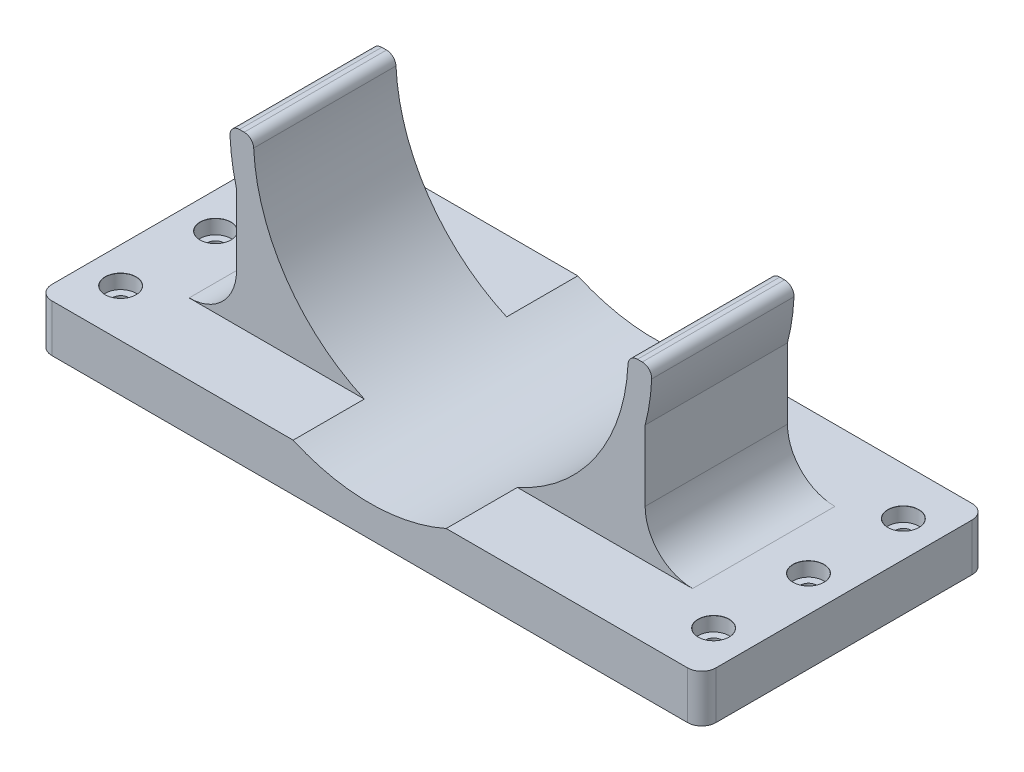
from build123d import *

# Parameters (mm, degrees)
BOSS_EXTRUDE3_DEPTH           = 30
BOSS_EXTRUDE3_DEPTH_BACK      = 30
BOSS_EXTRUDE4_DEPTH           = 15
BOSS_EXTRUDE4_DEPTH_BACK      = 15
BOSS_EXTRUDE5_DEPTH           = 15
BOSS_EXTRUDE5_DEPTH_BACK      = 15
FILLET1_R                     = 10
CBORE_FOR_M3_SHCS1_AT_2_COUNT = 2
CBORE_FOR_M3_SHCS1_AT_2_PITCH = 125
LPATTERN1_COUNT               = 2
LPATTERN1_PITCH               = 20
LPATTERN1_COL_COUNT           = 2
LPATTERN1_COL_PITCH           = 20
FILLET2_R                     = 2
FILLET3_R                     = 3


with BuildPart() as part:
    # Sketch1 → Boss-Extrude3 (new, two sides: drawn at the far end of the back side and taken through both)
    with BuildSketch(Plane.XY.offset(-BOSS_EXTRUDE3_DEPTH_BACK)):
        with BuildLine():
            Line((-43.065388601, -36.056178761), (-70, -36.056178761))
            Line((-70, -36.056178761), (-70, -46.056178761))
            Line((-70, -46.056178761), (70, -46.056178761))
            Line((70, -46.056178761), (70, -36.056178761))
            Line((70, -36.056178761), (43.065388601, -36.056178761))
            Line((43.065388601, -36.056178761), (26.080681992, -36.056178761))
            Line((26.080681992, -36.056178761), (16.130777202, -36.056178761))
            ThreePointArc((16.130777202, -36.056178761), (0, -39.5), (-16.130777202, -36.056178761))
            Line((-16.130777202, -36.056178761), (-26.080681992, -36.056178761))
            Line((-26.080681992, -36.056178761), (-43.065388601, -36.056178761))
        make_face()
    extrude(amount=BOSS_EXTRUDE3_DEPTH + BOSS_EXTRUDE3_DEPTH_BACK)

    # Sketch1<6> → Boss-Extrude4 (add, two sides: drawn at the far end of the back side and taken through both)
    with BuildSketch(Plane.XY.offset(-BOSS_EXTRUDE4_DEPTH_BACK)):
        with BuildLine():
            ThreePointArc((-44.5, 0), (-39.628527279, -20.24425414), (-26.080681992, -36.056178761))
            Line((-26.080681992, -36.056178761), (-16.130777202, -36.056178761))
            ThreePointArc((-16.130777202, -36.056178761), (-33.146762281, -21.483532071), (-39.5, 0))
            Line((-39.5, 0), (-44.5, 0))
        make_face()
        with BuildLine():
            ThreePointArc((39.5, 0), (33.146762281, -21.483532071), (16.130777202, -36.056178761))
            Line((16.130777202, -36.056178761), (26.080681992, -36.056178761))
            ThreePointArc((26.080681992, -36.056178761), (39.628527279, -20.24425414), (44.5, 0))
            Line((44.5, 0), (39.5, 0))
        make_face()
    extrude(amount=BOSS_EXTRUDE4_DEPTH + BOSS_EXTRUDE4_DEPTH_BACK)

    # Sketch1<7> → Boss-Extrude5 (add, two sides: drawn at the far end of the back side and taken through both)
    with BuildSketch(Plane.XY.offset(-BOSS_EXTRUDE5_DEPTH_BACK)):
        with BuildLine():
            Line((-43.065388601, -11.208135645), (-43.065388601, -36.056178761))
            Line((-43.065388601, -36.056178761), (-26.080681992, -36.056178761))
            ThreePointArc((-26.080681992, -36.056178761), (-36.737597653, -25.111728708), (-43.065388601, -11.208135645))
        make_face()
        with BuildLine():
            Line((26.080681992, -36.056178761), (43.065388601, -36.056178761))
            Line((43.065388601, -36.056178761), (43.065388601, -11.208135645))
            ThreePointArc((43.065388601, -11.208135645), (36.737597653, -25.111728708), (26.080681992, -36.056178761))
        make_face()
    extrude(amount=BOSS_EXTRUDE5_DEPTH + BOSS_EXTRUDE5_DEPTH_BACK)

    # Fillet1
    fillet1_edges = [part.edges().sort_by_distance(p)[0] for p in [
        (43.065388601, -36.056178761, 0),
        (-43.065388601, -36.056178761, 0),
    ]]
    fillet(fillet1_edges, radius=FILLET1_R)

    # Sketch4 → CBORE for M3 SHCS1 (revolve, cut)
    with BuildSketch(Plane(origin=(-62.5, -36.056178761, 0), x_dir=(0, 0, 1), z_dir=(1, 0, 0))):
        Polygon((0, 0), (0, 10), (1.7, 10), (1.7, 3), (3.25, 3), (3.25, 0.025), (3.275, 0), align=None)
    cbore_for_m3_shcs1 = revolve(axis=Axis((-62.5, -29.706178761, 0), (0, -1, 0)), mode=Mode.SUBTRACT)

    # CBORE for M3 SHCS1 at 2: CBORE for M3 SHCS1 ×2
    with Locations(*[(i * CBORE_FOR_M3_SHCS1_AT_2_PITCH, 0, 0) for i in range(1, CBORE_FOR_M3_SHCS1_AT_2_COUNT)]):
        add(cbore_for_m3_shcs1, mode=Mode.SUBTRACT)

    # LPattern1: CBORE for M3 SHCS1 ×2
    with Locations(*[(0, 0, -i * LPATTERN1_PITCH) for i in range(1, LPATTERN1_COUNT)]):
        add(cbore_for_m3_shcs1, mode=Mode.SUBTRACT)

    # LPattern1 copy 1 sketch → LPattern1 copy 1 (revolve, cut)
    with BuildSketch(Plane(origin=(62.5, -36.056178761, -20), x_dir=(0, 0, 1), z_dir=(1, 0, 0))):
        Polygon((0, 0), (0, 10), (1.7, 10), (1.7, 3), (3.25, 3), (3.25, 0.025), (3.275, 0), align=None)
    revolve(axis=Axis((62.5, -29.706178761, -20), (0, -1, 0)), mode=Mode.SUBTRACT)

    # LPattern1 col: CBORE for M3 SHCS1 ×2
    with Locations(*[(0, 0, i * LPATTERN1_COL_PITCH) for i in range(1, LPATTERN1_COL_COUNT)]):
        add(cbore_for_m3_shcs1, mode=Mode.SUBTRACT)

    # LPattern1 col copy 1 sketch → LPattern1 col copy 1 (revolve, cut)
    with BuildSketch(Plane(origin=(62.5, -36.056178761, 20), x_dir=(0, 0, 1), z_dir=(1, 0, 0))):
        Polygon((0, 0), (0, 10), (1.7, 10), (1.7, 3), (3.25, 3), (3.25, 0.025), (3.275, 0), align=None)
    revolve(axis=Axis((62.5, -29.706178761, 20), (0, -1, 0)), mode=Mode.SUBTRACT)

    # Fillet2
    fillet2_edges = [part.edges().sort_by_distance(p)[0] for p in [
        (-44.5, 0, 0),
        (-39.5, 0, 0),
        (44.5, 0, 0),
        (39.5, 0, 0),
    ]]
    fillet(fillet2_edges, radius=FILLET2_R)

    # Fillet3
    fillet3_edges = [part.edges().sort_by_distance(p)[0] for p in [
        (-70, -41.056178761, 30),
        (-70, -41.056178761, -30),
        (70, -41.056178761, -30),
        (70, -41.056178761, 30),
    ]]
    fillet(fillet3_edges, radius=FILLET3_R)


solid = part.part
